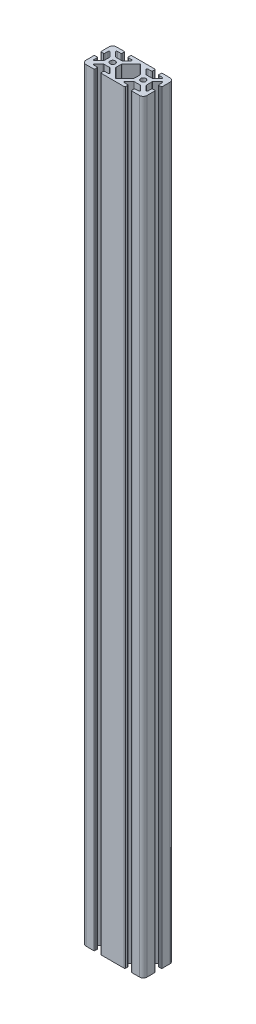
from build123d import *

# Parameters (mm, degrees)
BOSS_EXTRUDE1_DEPTH   = 1000
SKETCH3_R             = 3.4
CUT_EXTRUDE1_DEPTH    = 1000
CUT_EXTRUDE2_DEPTH    = 1000
FILLET1_R             = 1
FILLET2_R             = 1
FILLET3_R             = 1
CUT_EXTRUDE3_DEPTH    = 1000
CUT_EXTRUDE4_DEPTH    = 1000
FILLET4_R             = 1
FILLET5_R             = 1
FILLET6_R             = 1
FILLET7_R             = 1
FILLET8_R             = 1
FILLET9_R             = 1
FILLET10_R            = 1
FILLET11_R            = 1
MIRROR11_COPY_1_DEPTH = 1000
MIRROR11_COPY_2_DEPTH = 1000
CUT_EXTRUDE5_DEPTH    = 1000


with BuildPart() as part:
    # Sketch1 → Boss-Extrude1 (new body)
    with BuildSketch(Plane(origin=(0, 0, 0), x_dir=(1, 0, 0), z_dir=(0, 1, 0))):
        with BuildLine():
            Line((5, 0), (75, 0))
            ThreePointArc((75, 0), (78.535533906, -1.464466094), (80, -5))
            Line((80, -5), (80, -35))
            ThreePointArc((80, -35), (78.535533906, -38.535533906), (75, -40))
            Line((75, -40), (5, -40))
            ThreePointArc((5, -40), (1.464466094, -38.535533906), (0, -35))
            Line((0, -35), (0, -5))
            ThreePointArc((0, -5), (1.464466094, -1.464466094), (5, 0))
        make_face()
    extrude(amount=BOSS_EXTRUDE1_DEPTH)

    # Sketch3 → Cut-Extrude1 (cut)
    with BuildSketch(Plane(origin=(0, 1000, 0), x_dir=(1, 0, 0), z_dir=(0, 1, 0))):
        with Locations(Location((20, -20, 0), (0, 0, 270))):
            Circle(SKETCH3_R)
    cut_extrude1 = extrude(amount=-CUT_EXTRUDE1_DEPTH, mode=Mode.SUBTRACT)

    # Mirror3: Cut-Extrude1 across plane
    add(cut_extrude1.mirror(Plane(origin=(40, 0, 0), x_dir=(0, 0, 1), z_dir=(1, 0, 0))), mode=Mode.SUBTRACT)

    # Sketch7 → Cut-Extrude2 (cut)
    with BuildSketch(Plane(origin=(0, 0, 0), x_dir=(-1, 0, 0), z_dir=(0, -1, 0))):
        with BuildLine():
            Line((-15.9, -40), (-24.1, -40))
            Line((-24.1, -40), (-24.1, -36.5))
            ThreePointArc((-24.1, -36.5), (-24.392893219, -35.792893219), (-25.1, -35.5))
            Line((-25.1, -35.5), (-29.489753594, -35.5))
            ThreePointArc((-29.489753594, -35.5), (-30.415270825, -34.8787055), (-30.190750526, -33.786835712))
            Line((-30.190750526, -33.786835712), (-24.391814382, -28.086835712))
            ThreePointArc((-24.391814382, -28.086835712), (-24.069522951, -27.874482769), (-23.69081745, -27.8))
            Line((-23.69081745, -27.8), (-16.309186536, -27.8))
            ThreePointArc((-16.309186536, -27.8), (-15.930477876, -27.874484063), (-15.608184734, -28.086840499))
            Line((-15.608184734, -28.086840499), (-9.809327805, -33.786840499))
            ThreePointArc((-9.809327805, -33.786840499), (-9.584813669, -34.87870866), (-10.510329607, -35.5))
            Line((-10.510329607, -35.5), (-14.9, -35.5))
            ThreePointArc((-14.9, -35.5), (-15.607106781, -35.792893219), (-15.9, -36.5))
            Line((-15.9, -36.5), (-15.9, -40))
        make_face()
    cut_extrude2 = extrude(amount=-CUT_EXTRUDE2_DEPTH, mode=Mode.SUBTRACT)

    # Fillet1
    fillet1_edges = [part.edges().sort_by_distance(p)[0] for p in [
        (15.9, 500, 40),
        (24.1, 500, 40),
    ]]
    fillet(fillet1_edges, radius=FILLET1_R)

    # Mirror8: Cut-Extrude2 across plane
    add(cut_extrude2.mirror(Plane(origin=(40, 0, 0), x_dir=(0, 0, 1), z_dir=(1, 0, 0))), mode=Mode.SUBTRACT)

    # Fillet2
    fillet2_edges = [part.edges().sort_by_distance(p)[0] for p in [
        (55.9, 500, 40),
    ]]
    fillet(fillet2_edges, radius=FILLET2_R)

    # Fillet3
    fillet3_edges = [part.edges().sort_by_distance(p)[0] for p in [
        (64.1, 500, 40),
    ]]
    fillet(fillet3_edges, radius=FILLET3_R)

    # Sketch9 → Cut-Extrude3 (cut)
    with BuildSketch(Plane(origin=(0, 0, 0), x_dir=(1, 0, 0), z_dir=(0, 1, 0))):
        with BuildLine():
            Line((14.899846923, -4.500713815), (10.450461284, -4.500713815))
            ThreePointArc((10.450461284, -4.500713815), (9.526581751, -5.118030383), (9.743354502, -6.207820596))
            Line((9.743354502, -6.207820596), (15.442640687, -11.907106781))
            ThreePointArc((15.442640687, -11.907106781), (15.767064036, -12.123879533), (16.149747468, -12.2))
            Line((16.149747468, -12.2), (23.850252532, -12.2))
            ThreePointArc((23.850252532, -12.2), (24.232935964, -12.123879533), (24.557359313, -11.907106781))
            Line((24.557359313, -11.907106781), (30.257359313, -6.207106781))
            ThreePointArc((30.257359313, -6.207106781), (30.474132064, -5.117316568), (29.550252532, -4.5))
            Line((29.550252532, -4.5), (25.099846964, -4.5))
            ThreePointArc((25.099846964, -4.5), (24.392724723, -4.207091321), (24.099846965, -3.499956273))
            Line((24.099846965, -3.499956273), (24.100000008, 0))
            Line((24.100000008, 0), (15.9, 0))
            Line((15.9, 0), (15.899846922, -3.500757542))
            ThreePointArc((15.899846922, -3.500757542), (15.606938244, -4.207836056), (14.899846923, -4.500713815))
        make_face()
    cut_extrude3 = extrude(amount=CUT_EXTRUDE3_DEPTH, mode=Mode.SUBTRACT)

    # Mirror9: Cut-Extrude3 across plane
    add(cut_extrude3.mirror(Plane(origin=(40, 0, 0), x_dir=(0, 0, 1), z_dir=(1, 0, 0))), mode=Mode.SUBTRACT)

    # Sketch10 → Cut-Extrude4 (cut)
    with BuildSketch(Plane(origin=(0, 0, 0), x_dir=(1, 0, 0), z_dir=(0, 1, 0))):
        with BuildLine():
            Line((4.5, -14.9), (4.5, -10.58605332))
            ThreePointArc((4.5, -10.58605332), (5.126159695, -9.658560233), (6.220486853, -9.892584724))
            Line((6.220486853, -9.892584724), (11.920486853, -15.814662646))
            ThreePointArc((11.920486853, -15.814662646), (12.127493087, -16.134290938), (12.2, -16.508131242))
            Line((12.2, -16.508131242), (12.2, -23.491868758))
            ThreePointArc((12.2, -23.491868758), (12.127493087, -23.865709062), (11.920486853, -24.185337354))
            Line((11.920486853, -24.185337354), (6.220486853, -30.107415276))
            ThreePointArc((6.220486853, -30.107415276), (5.126159695, -30.341439767), (4.5, -29.41394668))
            Line((4.5, -29.41394668), (4.5, -25.1))
            ThreePointArc((4.5, -25.1), (4.207106781, -24.392893219), (3.5, -24.1))
            Line((3.5, -24.1), (0, -24.1))
            Line((0, -24.1), (0, -15.9))
            Line((0, -15.9), (3.5, -15.9))
            ThreePointArc((3.5, -15.9), (4.207106781, -15.607106781), (4.5, -14.9))
        make_face()
    cut_extrude4 = extrude(amount=CUT_EXTRUDE4_DEPTH, mode=Mode.SUBTRACT)

    # Fillet4
    fillet4_edges = [part.edges().sort_by_distance(p)[0] for p in [
        (24.100000008, 500, 0),
    ]]
    fillet(fillet4_edges, radius=FILLET4_R)

    # Fillet5
    fillet5_edges = [part.edges().sort_by_distance(p)[0] for p in [
        (64.1, 500, 0),
    ]]
    fillet(fillet5_edges, radius=FILLET5_R)

    # Fillet6
    fillet6_edges = [part.edges().sort_by_distance(p)[0] for p in [
        (55.899999992, 500, 0),
    ]]
    fillet(fillet6_edges, radius=FILLET6_R)

    # Fillet7
    fillet7_edges = [part.edges().sort_by_distance(p)[0] for p in [
        (15.9, 500, 0),
    ]]
    fillet(fillet7_edges, radius=FILLET7_R)

    # Fillet8
    fillet8_edges = [part.edges().sort_by_distance(p)[0] for p in [
        (0, 500, 24.1),
    ]]
    fillet(fillet8_edges, radius=FILLET8_R)

    # Fillet9
    fillet9_edges = [part.edges().sort_by_distance(p)[0] for p in [
        (0, 500, 15.9),
    ]]
    fillet(fillet9_edges, radius=FILLET9_R)

    # Mirror10: Cut-Extrude4 across plane
    add(cut_extrude4.mirror(Plane(origin=(40, 0, 0), x_dir=(0, 0, 1), z_dir=(1, 0, 0))), mode=Mode.SUBTRACT)

    # Fillet10
    fillet10_edges = [part.edges().sort_by_distance(p)[0] for p in [
        (80, 500, 15.9),
    ]]
    fillet(fillet10_edges, radius=FILLET10_R)

    # Fillet11
    fillet11_edges = [part.edges().sort_by_distance(p)[0] for p in [
        (80, 500, 24.1),
    ]]
    fillet(fillet11_edges, radius=FILLET11_R)

    # Mirror11 copy 1 sketch → Mirror11 copy 1 (cut)
    with BuildSketch(Plane(origin=(40, 0, 0), x_dir=(1, 0, 0), z_dir=(0, 1, 0))):
        with BuildLine():
            Line((4.5, -14.9), (4.5, -10.58605332))
            ThreePointArc((4.5, -10.58605332), (5.126159695, -9.658560233), (6.220486853, -9.892584724))
            Line((6.220486853, -9.892584724), (11.920486853, -15.814662646))
            ThreePointArc((11.920486853, -15.814662646), (12.127493087, -16.134290938), (12.2, -16.508131242))
            Line((12.2, -16.508131242), (12.2, -23.491868758))
            ThreePointArc((12.2, -23.491868758), (12.127493087, -23.865709062), (11.920486853, -24.185337354))
            Line((11.920486853, -24.185337354), (6.220486853, -30.107415276))
            ThreePointArc((6.220486853, -30.107415276), (5.126159695, -30.341439767), (4.5, -29.41394668))
            Line((4.5, -29.41394668), (4.5, -25.1))
            ThreePointArc((4.5, -25.1), (4.207106781, -24.392893219), (3.5, -24.1))
            Line((3.5, -24.1), (0, -24.1))
            Line((0, -24.1), (0, -15.9))
            Line((0, -15.9), (3.5, -15.9))
            ThreePointArc((3.5, -15.9), (4.207106781, -15.607106781), (4.5, -14.9))
        make_face()
    extrude(amount=MIRROR11_COPY_1_DEPTH, mode=Mode.SUBTRACT)

    # Mirror11 copy 2 sketch → Mirror11 copy 2 (cut)
    with BuildSketch(Plane(origin=(120, 0, 0), x_dir=(-1, 0, 0), z_dir=(0, 1, 0))):
        with BuildLine():
            Line((4.5, 14.9), (4.5, 10.58605332))
            ThreePointArc((4.5, 10.58605332), (5.126159695, 9.658560233), (6.220486853, 9.892584724))
            Line((6.220486853, 9.892584724), (11.920486853, 15.814662646))
            ThreePointArc((11.920486853, 15.814662646), (12.127493087, 16.134290938), (12.2, 16.508131242))
            Line((12.2, 16.508131242), (12.2, 23.491868758))
            ThreePointArc((12.2, 23.491868758), (12.127493087, 23.865709062), (11.920486853, 24.185337354))
            Line((11.920486853, 24.185337354), (6.220486853, 30.107415276))
            ThreePointArc((6.220486853, 30.107415276), (5.126159695, 30.341439767), (4.5, 29.41394668))
            Line((4.5, 29.41394668), (4.5, 25.1))
            ThreePointArc((4.5, 25.1), (4.207106781, 24.392893219), (3.5, 24.1))
            Line((3.5, 24.1), (0, 24.1))
            Line((0, 24.1), (0, 15.9))
            Line((0, 15.9), (3.5, 15.9))
            ThreePointArc((3.5, 15.9), (4.207106781, 15.607106781), (4.5, 14.9))
        make_face()
    extrude(amount=MIRROR11_COPY_2_DEPTH, mode=Mode.SUBTRACT)

    # Mirror12: Cut-Extrude4 across plane
    add(cut_extrude4.mirror(Plane.ZY.offset(-20)), mode=Mode.SUBTRACT)

    # Sketch12 → Cut-Extrude5 (cut)
    with BuildSketch(Plane(origin=(0, 0, 0), x_dir=(-1, 0, 0), z_dir=(0, -1, 0))):
        with BuildLine():
            Line((-28.079513147, -24.185337354), (-39.327067998, -35.871108628))
            ThreePointArc((-39.327067998, -35.871108628), (-40.049082116, -36.177638866), (-40.770156561, -35.868904648))
            Line((-40.770156561, -35.868904648), (-51.922601709, -24.210885791))
            ThreePointArc((-51.922601709, -24.210885791), (-52.128062958, -23.892044517), (-52.2, -23.519621175))
            Line((-52.2, -23.519621175), (-52.2, -16.508131242))
            ThreePointArc((-52.2, -16.508131242), (-52.127493087, -16.134290938), (-51.920486853, -15.814662646))
            Line((-51.920486853, -15.814662646), (-40.720486853, -4.17829901))
            ThreePointArc((-40.720486853, -4.17829901), (-40, -3.871767606), (-39.279513147, -4.17829901))
            Line((-39.279513147, -4.17829901), (-28.079513147, -15.814662646))
            ThreePointArc((-28.079513147, -15.814662646), (-27.872506913, -16.134290938), (-27.8, -16.508131242))
            Line((-27.8, -16.508131242), (-27.8, -23.491868758))
            ThreePointArc((-27.8, -23.491868758), (-27.872506913, -23.865709062), (-28.079513147, -24.185337354))
        make_face()
    extrude(amount=-CUT_EXTRUDE5_DEPTH, mode=Mode.SUBTRACT)


solid = part.part
